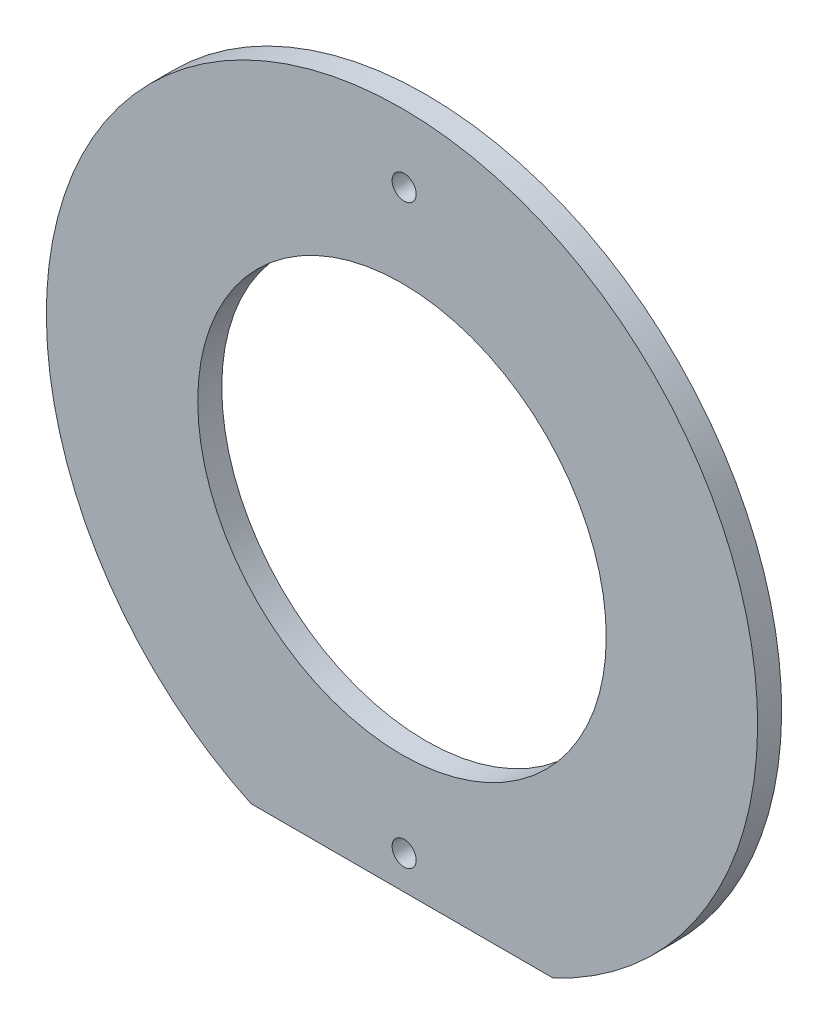
from build123d import *

# Parameters (mm, degrees)
BOSS_EXTRUDE1_DEPTH = 5
SKETCH2_R           = 2.5
CUT_EXTRUDE1_DEPTH  = 10
CUT_EXTRUDE2_REACH  = 225.261
SKETCH3_R           = 42.5


with BuildPart() as part:
    # Sketch1 → Boss-Extrude1 (new body)
    with BuildSketch(Plane.XY):
        with BuildLine():
            Line((-125.81358794, 5.502409601), (-62.980475651, 5.502409601))
            ThreePointArc((-62.980475651, 5.502409601), (-94.397031795, 146.502409601), (-125.81358794, 5.502409601))
        make_face()
    extrude(amount=BOSS_EXTRUDE1_DEPTH)

    # Sketch2 → Cut-Extrude1 (cut)
    with BuildSketch(Plane.XY.offset(5)):
        with Locations((-93.953395264, 132.502409601)):
            Circle(SKETCH2_R)
        with Locations((-93.953395264, 12.502409601)):
            Circle(SKETCH2_R)
    extrude(amount=-CUT_EXTRUDE1_DEPTH, mode=Mode.SUBTRACT)

    # Sketch3 → Cut-Extrude2 (cut, up to next)
    with BuildSketch(Plane.XY.offset(5), mode=Mode.PRIVATE) as cut_extrude2_sk1:
        with Locations((-94.397031795, 72.502409601)):
            Circle(SKETCH3_R)
    cut_extrude2_tool1 = extrude(cut_extrude2_sk1.sketch, amount=-CUT_EXTRUDE2_REACH, mode=Mode.PRIVATE) & part.part
    add(cut_extrude2_tool1.solids().sort_by_distance((-94.397032, 72.50241, 5))[0], mode=Mode.SUBTRACT)


solid = part.part
